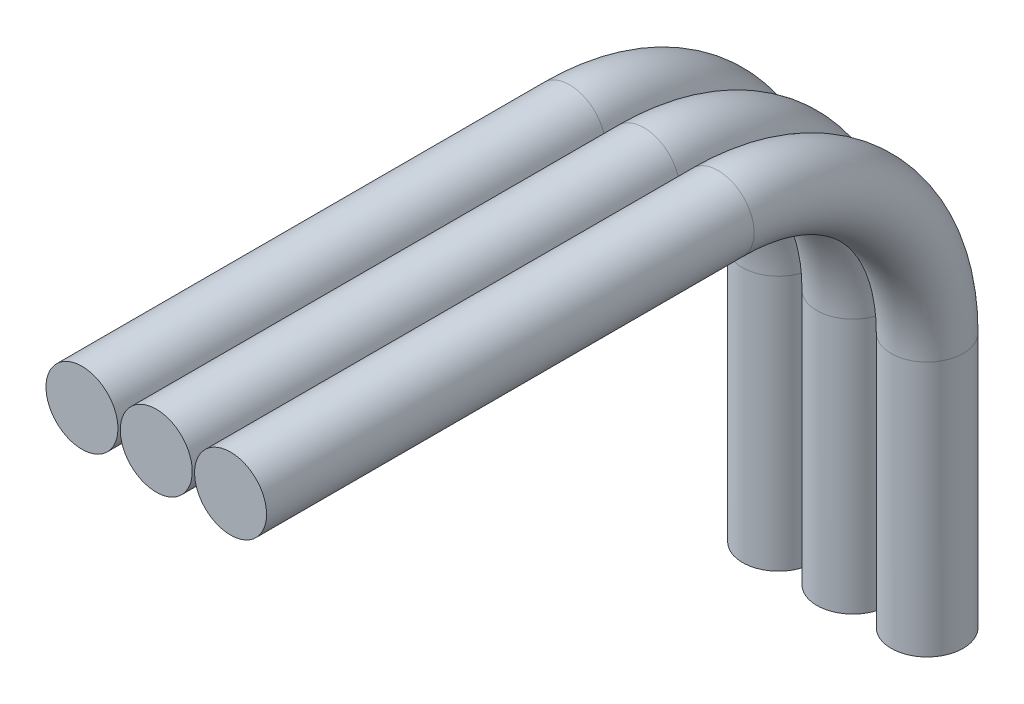
from build123d import *

# Parameters (mm, degrees)
SKETCH1_R             = 1.55
BOSS_EXTRUDE1_DEPTH   = 20
BOSS_EXTRUDE1_2_DEPTH = 20
BOSS_EXTRUDE1_3_DEPTH = 20
SKETCH2_R             = 1.55


with BuildPart() as part:
    # Sketch1 → Boss-Extrude1 (new body)
    with BuildSketch(Plane.XY):
        Circle(SKETCH1_R)
    extrude(amount=BOSS_EXTRUDE1_DEPTH)



with BuildPart() as body_2:
    # Sketch1 → Boss-Extrude1 2 (new body)
    with BuildSketch(Plane.XY):
        with Locations((3.2, 0)):
            Circle(SKETCH1_R)
    extrude(amount=BOSS_EXTRUDE1_2_DEPTH)


with BuildPart() as body_3:
    # Sketch1 → Boss-Extrude1 3 (new body)
    with BuildSketch(Plane.XY):
        with Locations((6.4, 0)):
            Circle(SKETCH1_R)
    extrude(amount=BOSS_EXTRUDE1_3_DEPTH)


with BuildPart() as part_1:
    add(part.part)

    add(body_2.part)  # Sweep2 merges body 2

    add(body_3.part)  # Sweep2 merges body 3
    # Sweep2: sweep along a path in Sketch3
    with BuildLine(Plane(origin=(0, 0, 0), x_dir=(0, 0, -1), z_dir=(1, 0, 0))) as sweep2_path:
        Line((0, 0), (1, 0))
        ThreePointArc((1, 0), (7.363961031, -2.636038969), (10, -9))
        Line((10, -9), (10, -20))
    # Sketch2 → Sweep2 (sweep)
    with BuildSketch(Plane.XY):
        with Locations((6.4, 0)):
            Circle(SKETCH2_R)
        with Locations((3.2, 0)):
            Circle(SKETCH2_R)
        Circle(SKETCH2_R)
    sweep(path=sweep2_path.line)


solid = part_1.part
